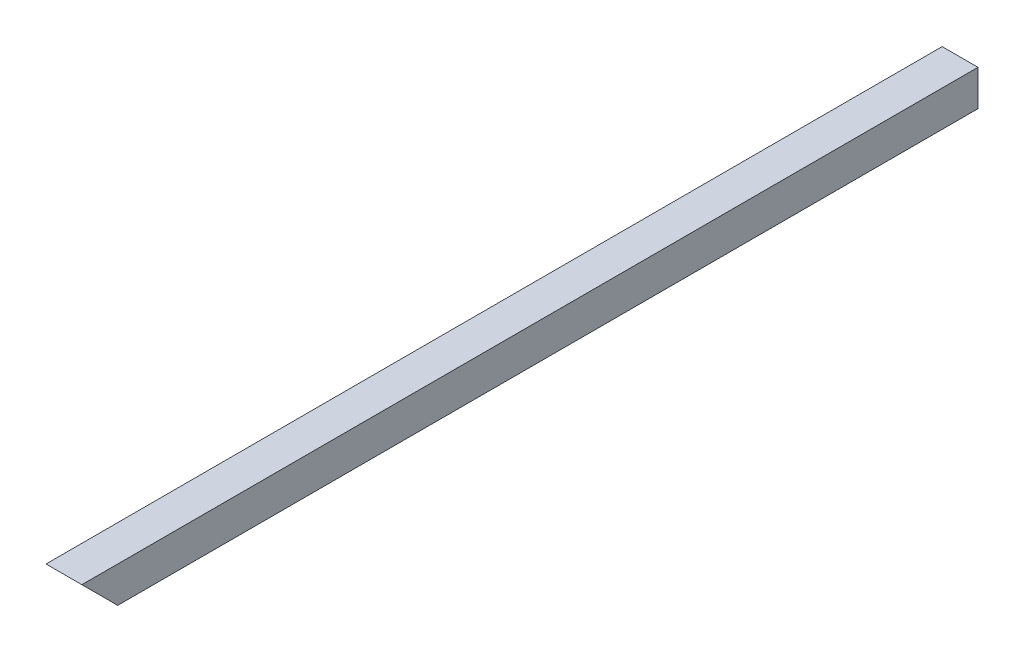
from build123d import *

# Parameters (mm, degrees)
SKETCH1_W           = 50
SKETCH1_H           = 50
SKETCH1_W_2         = 46
SKETCH1_H_2         = 46
BOSS_EXTRUDE1_DEPTH = 1250
CUT_EXTRUDE1_DEPTH  = 1252.249375624


with BuildPart() as part:
    # Sketch1 → Boss-Extrude1 (new body)
    with BuildSketch(Plane.XY):
        Rectangle(SKETCH1_W, SKETCH1_H)
        Rectangle(SKETCH1_W_2, SKETCH1_H_2, mode=Mode.SUBTRACT)
    extrude(amount=BOSS_EXTRUDE1_DEPTH)

    # Sketch2 → Cut-Extrude1 (cut, through all)
    with BuildSketch(Plane(origin=(25, 0, 0), x_dir=(0, 0, -1), z_dir=(1, 0, 0))):
        Polygon((-1250, 25), (-1250, -25), (-1200, -25), align=None)
    extrude(amount=-CUT_EXTRUDE1_DEPTH, mode=Mode.SUBTRACT)


solid = part.part
